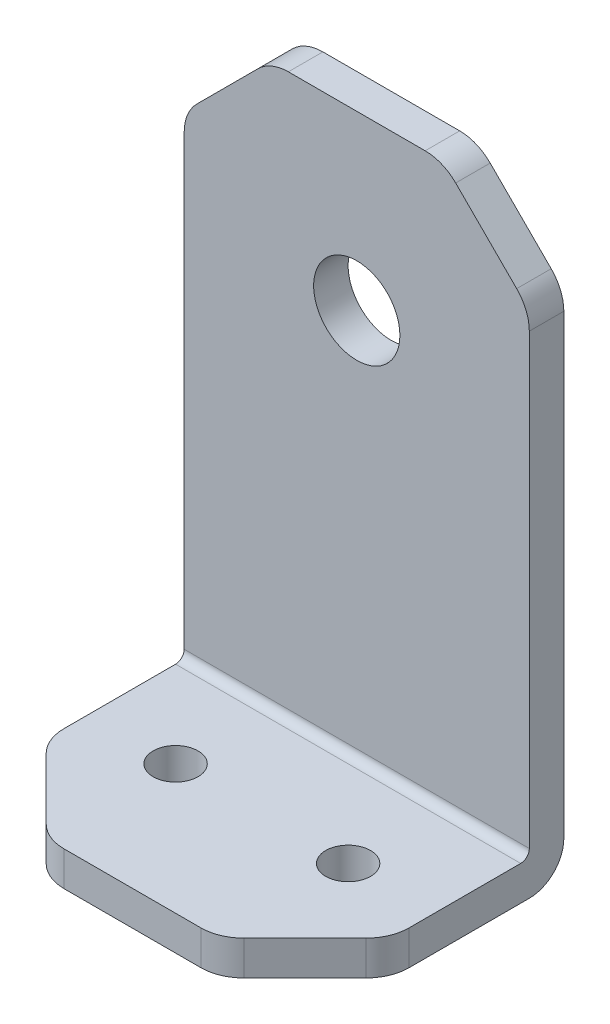
from build123d import *

# Parameters (mm, degrees)
SKETCH_1_W             = 40
SKETCH_1_H             = 30
EXTRUDE_1_DEPTH        = 4
SKETCH_3_W             = 40
SKETCH_3_H             = 4
EXTRUDE_2_DEPTH        = 65
FILLET_1_R             = 4
SKETCH_4_R             = 2.6
CUT_EXTRUDE_1_DEPTH    = 70.641941386
PATTERN_LINEAR_1_COUNT = 2
PATTERN_LINEAR_1_PITCH = 20
SKETCH_5_R             = 5
CUT_EXTRUDE_2_DEPTH    = 77.40026178
CHAMFER_1_SIZE         = 10
FILLET_2_R             = 5
FILLET_3_R             = 1


with BuildPart() as part:
    # 草圖1 → 填料-伸長1 (new body)
    with BuildSketch(Plane(origin=(0, 0, 0), x_dir=(1, 0, 0), z_dir=(0, 1, 0))):
        Rectangle(SKETCH_1_W, SKETCH_1_H)
    extrude(amount=EXTRUDE_1_DEPTH)

    # 草圖3 → 填料-伸長2 (add)
    with BuildSketch(Plane(origin=(0, 4, 0), x_dir=(1, 0, 0), z_dir=(0, 1, 0))):
        with Locations((0, 13)):
            Rectangle(SKETCH_3_W, SKETCH_3_H)
    extrude(amount=EXTRUDE_2_DEPTH)

    # 圓角1
    fillet_1_edges = [part.edges().sort_by_distance(p)[0] for p in [
        (0, 0, -15),
    ]]
    fillet(fillet_1_edges, radius=FILLET_1_R)

    # 草圖4 → 除料-伸長1 (cut, through all)
    with BuildSketch(Plane(origin=(0, 4, 0), x_dir=(1, 0, 0), z_dir=(0, 1, 0))):
        with Locations(Location((-10, 0, 0), (0, 0, 270))):
            Circle(SKETCH_4_R)
    cut_extrude_1 = extrude(amount=-CUT_EXTRUDE_1_DEPTH, mode=Mode.SUBTRACT)

    # 直線複製排列1: 除料-伸長1 ×2
    with Locations(*[(i * PATTERN_LINEAR_1_PITCH, 0, 0) for i in range(1, PATTERN_LINEAR_1_COUNT)]):
        add(cut_extrude_1, mode=Mode.SUBTRACT)

    # 草圖5 → 除料-伸長2 (cut, through all)
    with BuildSketch(Plane.XY.offset(-11)):
        with Locations((0, 49)):
            Circle(SKETCH_5_R)
    extrude(amount=-CUT_EXTRUDE_2_DEPTH, mode=Mode.SUBTRACT)

    # 導角1
    chamfer_1_edges = [part.edges().sort_by_distance(p)[0] for p in [
        (-20, 69, -13),
        (20, 69, -13),
        (20, 2, 15),
        (-20, 2, 15),
    ]]
    chamfer(chamfer_1_edges, length=CHAMFER_1_SIZE)

    # 圓角2
    fillet_2_edges = [part.edges().sort_by_distance(p)[0] for p in [
        (-10, 69, -13),
        (10, 69, -13),
        (20, 2, 5),
        (20, 59, -13),
        (-20, 2, 5),
        (-20, 59, -13),
        (10, 2, 15),
        (-10, 2, 15),
    ]]
    fillet(fillet_2_edges, radius=FILLET_2_R)

    # 圓角3
    fillet_3_edges = [part.edges().sort_by_distance(p)[0] for p in [
        (0, 4, -11),
    ]]
    fillet(fillet_3_edges, radius=FILLET_3_R)


solid = part.part
